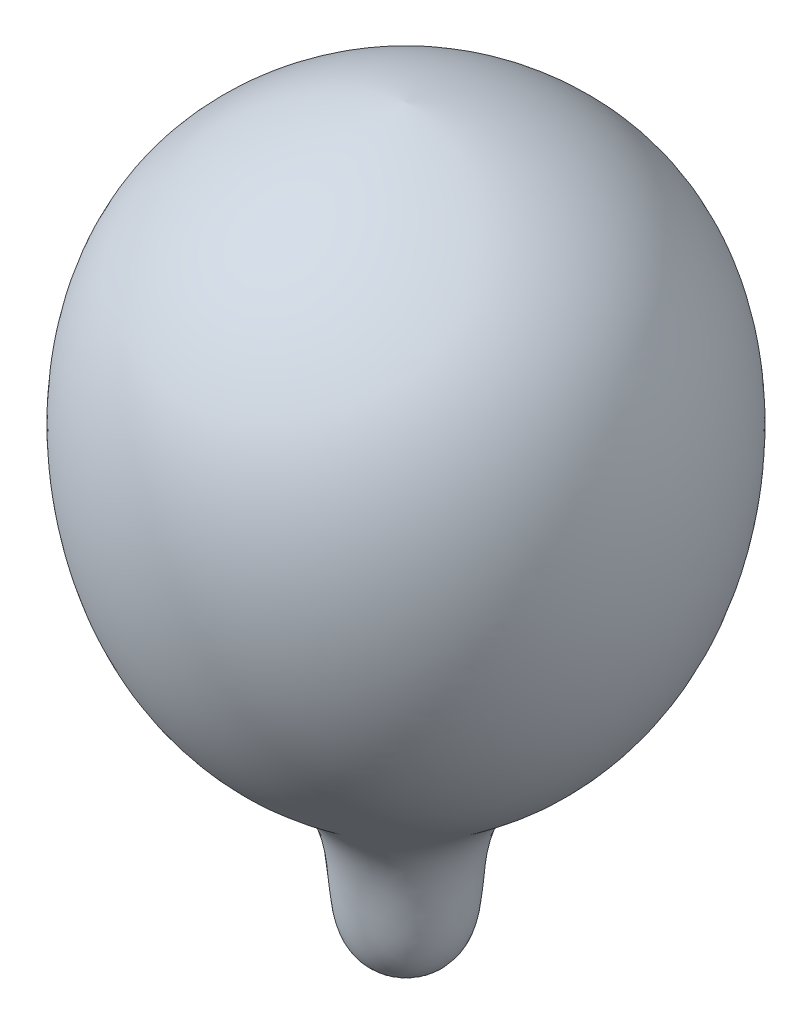
from build123d import *


with BuildPart() as part:
    # Sketch1 → Revolve1 (revolve)
    with BuildSketch(Plane.XY):
        with BuildLine():
            add(Edge.make_bspline(
                [(0, 154.376673304), (50.789597848, 148.745853307), (163.901108385, 96.344780466), (181.828978108, -79.773777952), (121.334705065, -195.770219444), (45.771564324, -239.569847756), (33.817219819, -300.68829119), (37.702453763, -340.34617196), (0, -347.294734483)],
                knots=[0, 0, 0, 0, 0.244025511, 0.505633153, 0.717447363, 0.831783835, 0.876368215, 1, 1, 1, 1], degree=3))
            Line((0, -347.294734483), (0, 154.376673304))
        make_face()
    revolve(axis=Axis((0, 154.376673304, 0), (0, -1, 0)))


solid = part.part
